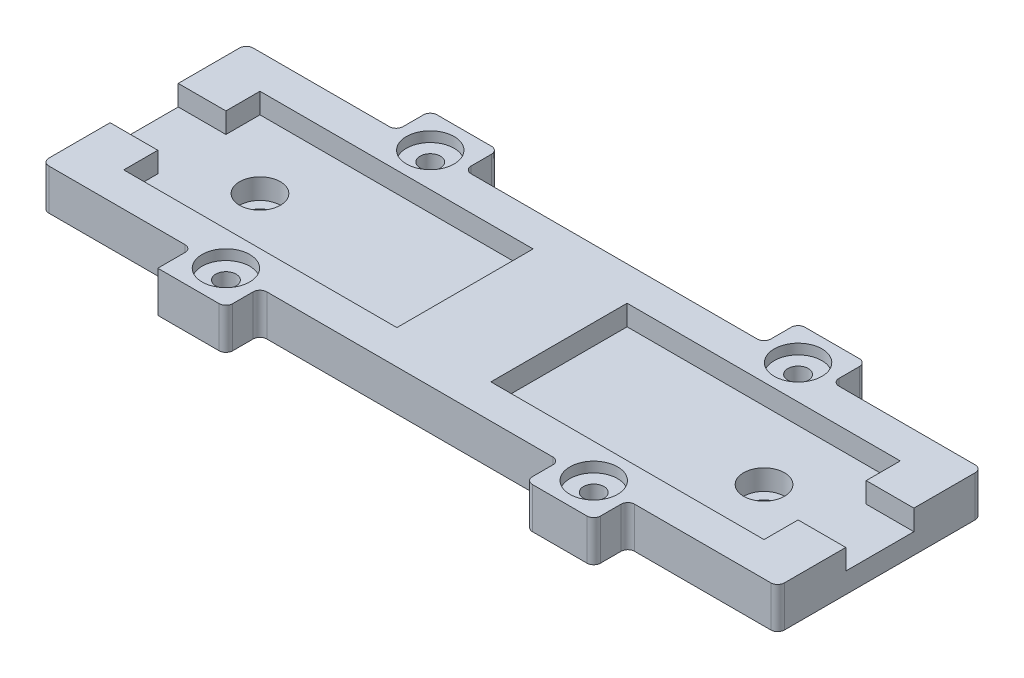
from build123d import *

# Parameters (mm, degrees)
SKETCH_1_W               = 108
SKETCH_1_H               = 30
SKETCH_1_W_2             = 10
SKETCH_1_H_2             = 5
EXTRUDE_1_DEPTH          = 6
SKETCH_2_R               = 1.5
CUT_EXTRUDE_1_DEPTH      = 6
SKETCH_3_W               = 94
SKETCH_3_H               = 20
CUT_EXTRUDE_2_DEPTH      = 3
SKETCH_4_R               = 6
EXTRUDE_2_DEPTH          = 3.5
SKETCH_5_R               = 3
CUT_EXTRUDE_3_DEPTH      = 1
SKETCH_6_R               = 1.5
CUT_EXTRUDE_4_DEPTH      = 59.208676329
CUT_EXTRUDE_START        = -3
SKETCH_7_R               = 3
CUT_EXTRUDE_5_DEPTH      = 3
SKETCH_8_R               = 3.5
CUT_EXTRUDE_6_DEPTH      = 1.5
FILLET_1_R               = 1
CUT_EXTRUDE_7_DEPTH      = 111
CUT_EXTRUDE_7_DEPTH_BACK = 111
SKETCH_9_W               = 10
SKETCH_9_H               = 3
SKETCH_10_W              = 13.8
SKETCH_10_H              = 20
EXTRUDE_3_DEPTH          = 3


with BuildPart() as part:
    # 草图1 → 凸台-拉伸1 (new body)
    with BuildSketch(Plane(origin=(0, 0, 0), x_dir=(1, 0, 0), z_dir=(0, 1, 0))):
        Rectangle(SKETCH_1_W, SKETCH_1_H)
        with Locations((-27, 17.5)):
            Rectangle(SKETCH_1_W_2, SKETCH_1_H_2)
        with Locations((27, 17.5)):
            Rectangle(SKETCH_1_W_2, SKETCH_1_H_2)
        with Locations((27, -17.5)):
            Rectangle(SKETCH_1_W_2, SKETCH_1_H_2)
        with Locations((-27, -17.5)):
            Rectangle(SKETCH_1_W_2, SKETCH_1_H_2)
    extrude(amount=EXTRUDE_1_DEPTH)

    # 草图2 → 切除-拉伸1 (cut)
    with BuildSketch(Plane(origin=(0, 6, 0), x_dir=(1, 0, 0), z_dir=(0, 1, 0))):
        with Locations(Location((27, -15, 0), (0, 0, 270))):
            Circle(SKETCH_2_R)
        with Locations(Location((-27, -15, 0), (0, 0, 270))):
            Circle(SKETCH_2_R)
        with Locations(Location((27, 15, 0), (0, 0, 270))):
            Circle(SKETCH_2_R)
        with Locations(Location((-27, 15, 0), (0, 0, 270))):
            Circle(SKETCH_2_R)
    extrude(amount=-CUT_EXTRUDE_1_DEPTH, mode=Mode.SUBTRACT)

    # 草图3 → 切除-拉伸2 (cut)
    with BuildSketch(Plane(origin=(0, 6, 0), x_dir=(1, 0, 0), z_dir=(0, 1, 0))):
        Rectangle(SKETCH_3_W, SKETCH_3_H)
    extrude(amount=-CUT_EXTRUDE_2_DEPTH, mode=Mode.SUBTRACT)

    # 草图4 → 凸台-拉伸2 (add)
    with BuildSketch(Plane.XZ):
        with Locations(Location((-37, 0, 0), (0, 0, 90))):
            Circle(SKETCH_4_R)
        with Locations(Location((37, 0, 0), (0, 0, 90))):
            Circle(SKETCH_4_R)
    extrude(amount=EXTRUDE_2_DEPTH)

    # 草图5 → 切除-拉伸3 (cut)
    with BuildSketch(Plane.XZ.offset(3.5)):
        with Locations(Location((-37, 0, 0), (0, 0, 270))):
            Circle(SKETCH_5_R)
        with Locations(Location((37, 0, 0), (0, 0, 90))):
            Circle(SKETCH_5_R)
    extrude(amount=-CUT_EXTRUDE_3_DEPTH, mode=Mode.SUBTRACT)

    # 草图6 → 切除-拉伸4 (cut, through all)
    with BuildSketch(Plane.XZ.offset(2.5)):
        with Locations(Location((-37, 0, 0), (0, 0, 270))):
            Circle(SKETCH_6_R)
        with Locations(Location((37, 0, 0), (0, 0, 270))):
            Circle(SKETCH_6_R)
    extrude(amount=-CUT_EXTRUDE_4_DEPTH, mode=Mode.SUBTRACT)

    # 草图7 → 切除-拉伸5 (cut)
    with BuildSketch(Plane(origin=(0, 3, 0), x_dir=(1, 0, 0), z_dir=(0, 1, 0)).offset(CUT_EXTRUDE_START)):
        with Locations(Location((-37, 0, 0), (0, 0, 90))):
            Circle(SKETCH_7_R)
        with Locations(Location((37, 0, 0), (0, 0, 270))):
            Circle(SKETCH_7_R)
    extrude(amount=CUT_EXTRUDE_5_DEPTH, mode=Mode.SUBTRACT)

    # 草图8 → 切除-拉伸6 (cut)
    with BuildSketch(Plane(origin=(0, 6, 0), x_dir=(1, 0, 0), z_dir=(0, 1, 0))):
        with Locations(Location((-27, 15, 0), (0, 0, 270))):
            Circle(SKETCH_8_R)
        with Locations(Location((27, 15, 0), (0, 0, 90))):
            Circle(SKETCH_8_R)
        with Locations(Location((27, -15, 0), (0, 0, 270))):
            Circle(SKETCH_8_R)
        with Locations(Location((-27, -15, 0), (0, 0, 90))):
            Circle(SKETCH_8_R)
    extrude(amount=-CUT_EXTRUDE_6_DEPTH, mode=Mode.SUBTRACT)

    # 圆角1
    fillet_1_edges = [part.edges().sort_by_distance(p)[0] for p in [
        (-54, 3, 15),
        (-54, 3, -15),
        (-32, 3, -15),
        (-32, 3, -20),
        (-22, 3, -20),
        (-22, 3, -15),
        (22, 3, -15),
        (22, 3, -20),
        (32, 3, -20),
        (32, 3, -15),
        (54, 3, -15),
        (54, 3, 15),
        (32, 3, 15),
        (32, 3, 20),
        (22, 3, 20),
        (22, 3, 15),
        (-22, 3, 15),
        (-22, 3, 20),
        (-32, 3, 15),
    ]]
    fillet(fillet_1_edges, radius=FILLET_1_R)

    # 草图9 → 切除-拉伸7 (cut, two sides: drawn at the far end of the back side and taken through both)
    with BuildSketch(Plane.ZY.offset(54).offset(-CUT_EXTRUDE_7_DEPTH_BACK)):
        with Locations((0, 4.5)):
            Rectangle(SKETCH_9_W, SKETCH_9_H)
    extrude(amount=CUT_EXTRUDE_7_DEPTH + CUT_EXTRUDE_7_DEPTH_BACK, mode=Mode.SUBTRACT)

    # 草图10 → 凸台-拉伸3 (add)
    with BuildSketch(Plane(origin=(0, 3, 0), x_dir=(1, 0, 0), z_dir=(0, 1, 0))):
        Rectangle(SKETCH_10_W, SKETCH_10_H)
    extrude(amount=EXTRUDE_3_DEPTH)


solid = part.part
